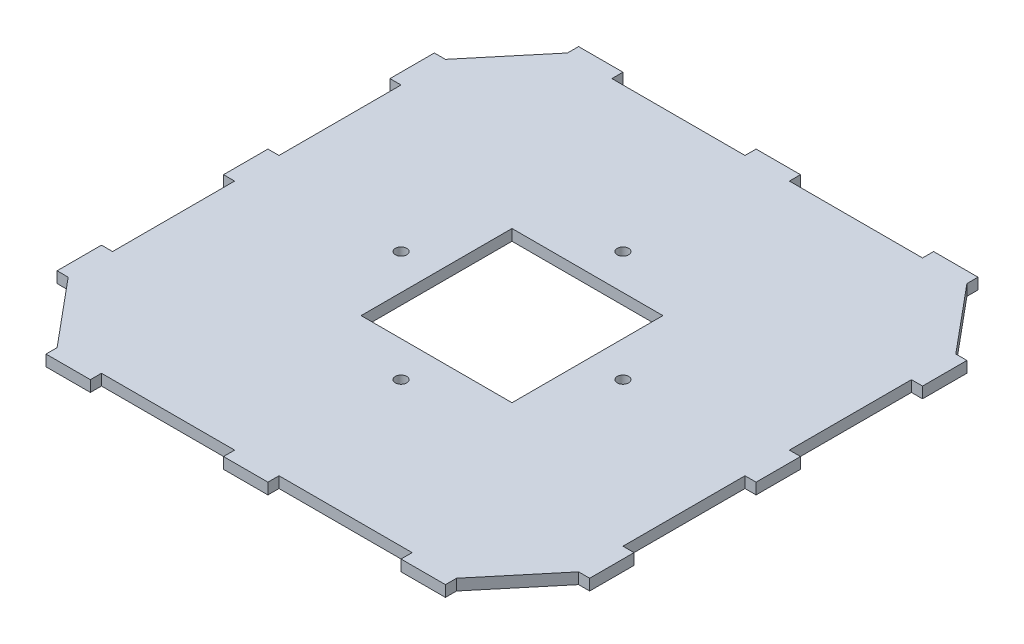
from build123d import *

# Parameters (mm, degrees)
SKETCH1_W           = 292.1
SKETCH1_H           = 292.1
BOSS_EXTRUDE1_DEPTH = 6.35
SKETCH3_W           = 25.4
SKETCH3_H           = 6.35
BOSS_EXTRUDE2_DEPTH = 6.35
SKETCH4_W           = 25.4
SKETCH4_H           = 6.35
BOSS_EXTRUDE3_DEPTH = 6.35
SKETCH5_R           = 3.25
SKETCH5_W           = 86.36
SKETCH5_H           = 86.36
CUT_EXTRUDE1_DEPTH  = 6.35


with BuildPart() as part:
    # Sketch1 → Boss-Extrude1 (new body)
    with BuildSketch(Plane(origin=(0, 0, 0), x_dir=(1, 0, 0), z_dir=(0, 1, 0))):
        with Locations((-8.203162495, -54.546418503)):
            Rectangle(SKETCH1_W, SKETCH1_H)
    extrude(amount=BOSS_EXTRUDE1_DEPTH)

    # Sketch3 → Boss-Extrude2 (add)
    with BuildSketch(Plane.ZY.offset(154.253162495)):
        with Locations((-40.703581497, 3.175)):
            Rectangle(SKETCH3_W, SKETCH3_H)
        with Locations((149.796418503, 3.175)):
            Rectangle(SKETCH3_W, SKETCH3_H)
        with Locations((54.546418503, 3.175)):
            Rectangle(SKETCH3_W, SKETCH3_H)
    boss_extrude2 = extrude(amount=BOSS_EXTRUDE2_DEPTH)

    # Mirror1: Boss-Extrude2 across plane
    add(boss_extrude2.mirror(Plane.ZY.offset(8.203162495)))

    # Sketch4 → Boss-Extrude3 (add)
    with BuildSketch(Plane(origin=(0, 0, -91.503581497), x_dir=(-1, 0, 0), z_dir=(0, 0, -1))):
        with Locations((-93.396837505, 3.175)):
            Rectangle(SKETCH4_W, SKETCH4_H)
        with Locations((109.803162495, 3.175)):
            Rectangle(SKETCH4_W, SKETCH4_H)
        with Locations((8.203162495, 3.175)):
            Rectangle(SKETCH4_W, SKETCH4_H)
    boss_extrude3 = extrude(amount=BOSS_EXTRUDE3_DEPTH)

    # Mirror2: Boss-Extrude3 across plane
    add(boss_extrude3.mirror(Plane.XY.offset(54.546418503)))

    # Sketch5 → Cut-Extrude1 (cut)
    with BuildSketch(Plane.XZ):
        with Locations(Location((-8.203162495, 118.046418503, 0), (0, 0, 270))):
            Circle(SKETCH5_R)
        with Locations(Location((55.296837505, 54.546418503, 0), (0, 0, 270))):
            Circle(SKETCH5_R)
        with Locations(Location((-8.203162495, -8.953581497, 0), (0, 0, 270))):
            Circle(SKETCH5_R)
        with Locations(Location((-71.703162495, 54.546418503, 0), (0, 0, 270))):
            Circle(SKETCH5_R)
        with Locations((-8.203162495, 54.546418503)):
            Rectangle(SKETCH5_W, SKETCH5_H)
        Polygon((106.096837505, 200.596418503), (137.846837505, 162.496418503), (137.846837505, 200.596418503), align=None)
        Polygon((-122.503162495, 200.596418503), (-154.253162495, 200.596418503), (-154.253162495, 162.496418503), align=None)
        Polygon((-154.253162495, -53.403581497), (-154.253162495, -91.503581497), (-122.503162495, -91.503581497), align=None)
        Polygon((106.096837505, -91.503581497), (137.846837505, -91.503581497), (137.846837505, -53.403581497), align=None)
    extrude(amount=-CUT_EXTRUDE1_DEPTH, mode=Mode.SUBTRACT)


solid = part.part
